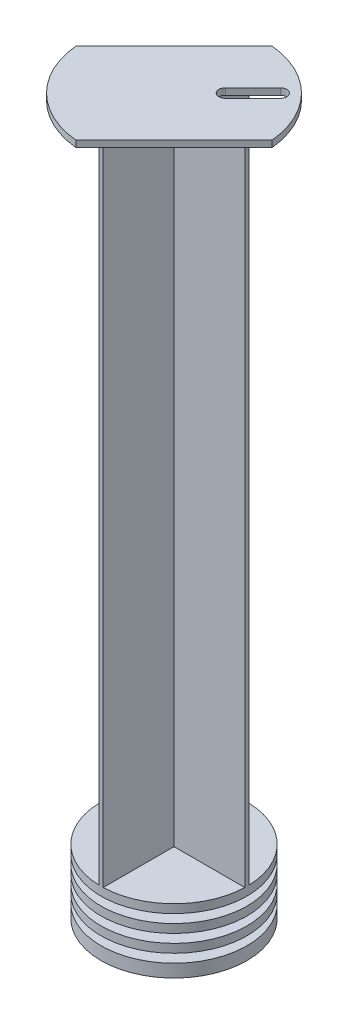
from build123d import *

# Parameters (mm, degrees)
SKETCH_1_R          = 17
EXTRUDE_1_DEPTH     = 15
SKETCH_2_W          = 6
SKETCH_2_H          = 2
EXTRUDE_2_DEPTH     = 150
SKETCH_5_R          = 21
EXTRUDE_3_DEPTH     = 1.5
CUT_EXTRUDE_START   = -5
CUT_EXTRUDE_1_DEPTH = 5


with BuildPart() as part:
    # 草图1 → 凸台-拉伸1 (new body)
    with BuildSketch(Plane(origin=(0, 0, 0), x_dir=(1, 0, 0), z_dir=(0, 1, 0))):
        with Locations(Location((0, 0, 0), (0, 0, 270))):
            Circle(SKETCH_1_R)
    extrude(amount=EXTRUDE_1_DEPTH)

    # 草图2 → 切除-旋转1 (revolve, cut)
    with BuildSketch(Plane.XY, mode=Mode.PRIVATE) as cut_revolve_1_sk:
        with Locations((-14, 12)):
            Rectangle(SKETCH_2_W, SKETCH_2_H)
        with Locations((-14, 8)):
            Rectangle(SKETCH_2_W, SKETCH_2_H)
        with Locations((-14, 4)):
            Rectangle(SKETCH_2_W, SKETCH_2_H)
    revolve(cut_revolve_1_sk.sketch.rotate(Axis((0, 0, 0), (0, 1, 0)), 270), axis=Axis((0, 0, 0), (0, 1, 0)), mode=Mode.SUBTRACT)

    # 草图3 → 旋转2 (revolve)
    with BuildSketch(Plane.XY, mode=Mode.PRIVATE) as revolve_2_sk:
        Polygon((0, 0), (-17, 0), (0, -5), align=None)
    revolve(revolve_2_sk.sketch.rotate(Axis((0, 0, 0), (0, 1, 0)), 270), axis=Axis((0, 0, 0), (0, 1, 0)))

    # 草图4 → 凸台-拉伸2 (add)
    with BuildSketch(Plane(origin=(0, 15, 0), x_dir=(1, 0, 0), z_dir=(0, 1, 0))):
        with BuildLine():
            Line((-0.5, 16.992645468), (-0.5, 0.5))
            Line((-0.5, 0.5), (-16.992645468, 0.5))
            ThreePointArc((-16.992645468, 0.5), (-17, 0), (-16.992645468, -0.5))
            Line((-16.992645468, -0.5), (-0.5, -0.5))
            Line((-0.5, -0.5), (-0.5, -16.992645468))
            ThreePointArc((-0.5, -16.992645468), (0, -17), (0.5, -16.992645468))
            Line((0.5, -16.992645468), (0.5, -0.5))
            Line((0.5, -0.5), (16.992645468, -0.5))
            ThreePointArc((16.992645468, -0.5), (17, 0), (16.992645468, 0.5))
            Line((16.992645468, 0.5), (0.5, 0.5))
            Line((0.5, 0.5), (0.5, 16.992645468))
            ThreePointArc((0.5, 16.992645468), (0, 17), (-0.5, 16.992645468))
        make_face()
    extrude(amount=EXTRUDE_2_DEPTH)

    # 草图5 → 凸台-拉伸3 (add)
    with BuildSketch(Plane(origin=(0, 165, 0), x_dir=(1, 0, 0), z_dir=(0, 1, 0))):
        with Locations(Location((0, 0, 0), (0, 0, 270))):
            Circle(SKETCH_5_R)
    extrude(amount=EXTRUDE_3_DEPTH)

    # 草图7 → 切除-拉伸1 (cut)
    with BuildSketch(Plane(origin=(0, 166.5, 0), x_dir=(1, 0, 0), z_dir=(0, 1, 0)).offset(CUT_EXTRUDE_START)):
        with BuildLine():
            ThreePointArc((21, 0), (20.978166703, 0.957351445), (20.912712211, 1.912712211))
            Line((20.912712211, 1.912712211), (19, 0))
            Line((19, 0), (-1.912712211, -20.912712211))
            ThreePointArc((-1.912712211, -20.912712211), (14.156854234, -15.510753631), (21, 0))
        make_face()
        with BuildLine():
            Line((11.313708499, 13.435028843), (4.915542193, 7.036862537))
            ThreePointArc((4.915542193, 7.036862537), (4.915542193, 4.915542193), (7.036862537, 4.915542193))
            Line((7.036862537, 4.915542193), (13.435028843, 11.313708499))
            ThreePointArc((13.435028843, 11.313708499), (13.435028843, 13.435028843), (11.313708499, 13.435028843))
        make_face()
        with BuildLine():
            Line((1.912712211, 20.912712211), (-20.912712211, -1.912712211))
            ThreePointArc((-20.912712211, -1.912712211), (-14.849242405, 14.849242405), (1.912712211, 20.912712211))
        make_face()
    extrude(amount=CUT_EXTRUDE_1_DEPTH, mode=Mode.SUBTRACT)


solid = part.part
